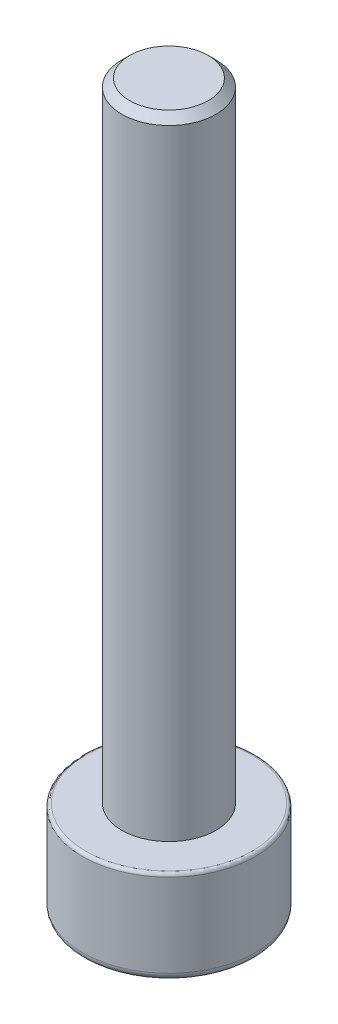
from build123d import *

# Parameters (mm, degrees)
SKETCH1_R           = 2.75
BOSS_EXTRUDE1_DEPTH = 3
SKETCH2_R           = 1.5
BOSS_EXTRUDE2_DEPTH = 20
CUT_EXTRUDE1_DEPTH  = 1.5
CHAMFER1_SIZE       = 0.25
FILLET1_R           = 0.25
CHAMFER2_SIZE       = 0.25
FILLET2_R           = 0.1


with BuildPart() as part:
    # Sketch1 → Boss-Extrude1 (new body)
    with BuildSketch(Plane(origin=(0, 0, 0), x_dir=(1, 0, 0), z_dir=(0, 1, 0))):
        with Locations(Location((0, 0, 0), (0, 0, 270))):
            Circle(SKETCH1_R)
    extrude(amount=BOSS_EXTRUDE1_DEPTH)

    # Sketch2 → Boss-Extrude2 (add)
    with BuildSketch(Plane(origin=(0, 3, 0), x_dir=(1, 0, 0), z_dir=(0, 1, 0))):
        with Locations(Location((0, 0, 0), (0, 0, 270))):
            Circle(SKETCH2_R)
    extrude(amount=BOSS_EXTRUDE2_DEPTH)

    # Sketch3 → Cut-Extrude1 (cut)
    with BuildSketch(Plane.XZ):
        Polygon((0.934168857, 0.974591477), (-0.376936549, 1.2963097), (-1.311105406, 0.321718223), (-0.934168857, -0.974591477), (0.376936549, -1.2963097), (1.311105406, -0.321718223), align=None)
    extrude(amount=-CUT_EXTRUDE1_DEPTH, mode=Mode.SUBTRACT)

    # Chamfer1
    chamfer1_edges = [part.edges().sort_by_distance(p)[0] for p in [
        (1.122637131, 0, 0.326436627),
        (0.278616154, 0, 1.135450588),
        (-0.844020977, 0, 0.809013962),
        (-1.122637131, 0, -0.326436627),
        (-0.278616154, 0, -1.135450588),
        (0.844020977, 0, -0.809013962),
    ]]
    chamfer(chamfer1_edges, length=CHAMFER1_SIZE)

    # Fillet1
    fillet1_edges = [part.edges().sort_by_distance(p)[0] for p in [
        (0, 0, -2.75),
    ]]
    fillet(fillet1_edges, radius=FILLET1_R)

    # Chamfer2
    chamfer2_edges = [part.edges().sort_by_distance(p)[0] for p in [
        (0, 23, -1.5),
    ]]
    chamfer(chamfer2_edges, length=CHAMFER2_SIZE)

    # Fillet2
    fillet2_edges = [part.edges().sort_by_distance(p)[0] for p in [
        (0, 3, -2.75),
    ]]
    fillet(fillet2_edges, radius=FILLET2_R)


solid = part.part
